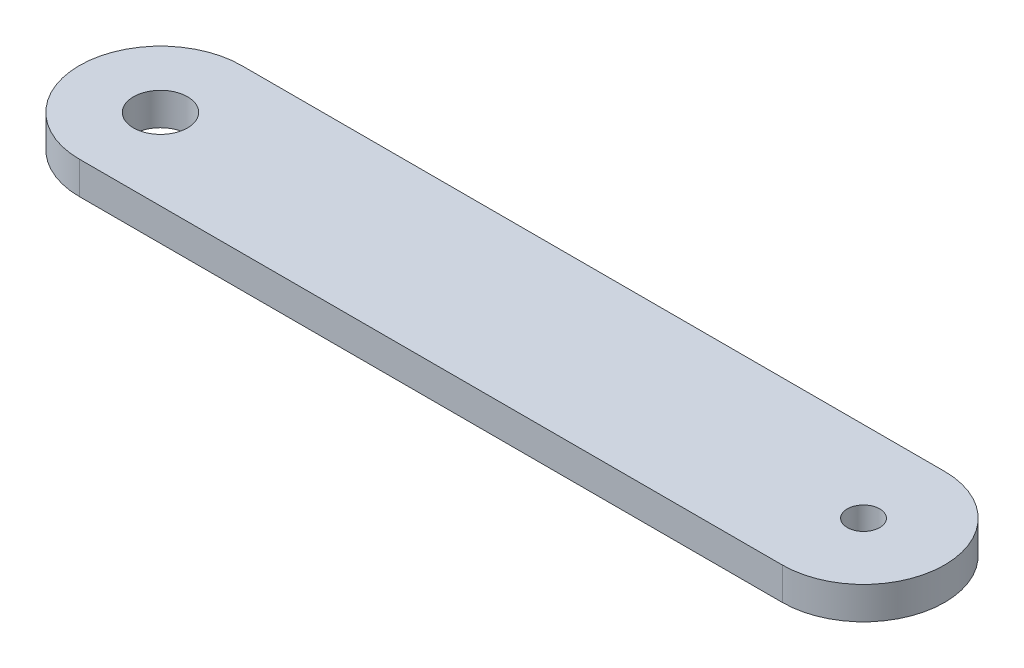
from build123d import *

# Parameters (mm, degrees)
SKETCH2_R           = 5
SKETCH2_R_2         = 3
BOSS_EXTRUDE1_DEPTH = 6


with BuildPart() as part:
    # Sketch2 → Boss-Extrude1 (new body)
    with BuildSketch(Plane(origin=(0, 0, 0), x_dir=(1, 0, 0), z_dir=(0, 1, 0))):
        with BuildLine():
            Line((-6.5, 28.5), (123.5, 28.5))
            ThreePointArc((123.5, 28.5), (138.5, 13.5), (123.5, -1.5))
            Line((123.5, -1.5), (-6.5, -1.5))
            ThreePointArc((-6.5, -1.5), (-21.5, 13.5), (-6.5, 28.5))
        make_face()
        with Locations(Location((-6.5, 13.5, 0), (0, 0, 270))):
            Circle(SKETCH2_R, mode=Mode.SUBTRACT)
        with Locations(Location((123.5, 13.5, 0), (0, 0, 270))):
            Circle(SKETCH2_R_2, mode=Mode.SUBTRACT)
    extrude(amount=BOSS_EXTRUDE1_DEPTH)


solid = part.part
